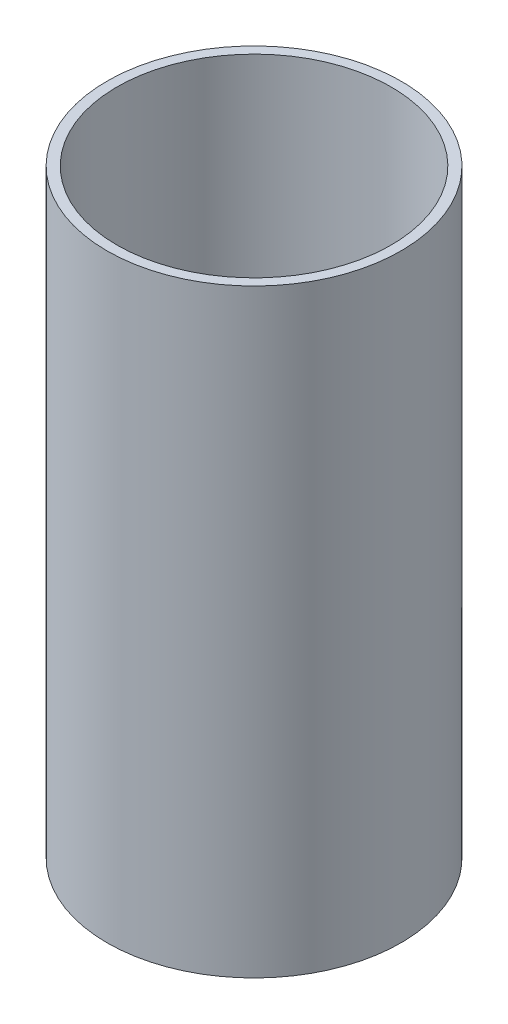
from build123d import *

# Parameters (mm, degrees)
ESQUISSE1_R        = 73.61
ESQUISSE1_R_2      = 68.61
BOSS_EXTRU_1_DEPTH = 300


with BuildPart() as part:
    # Esquisse1 → Boss.-Extru.1 (new body)
    with BuildSketch(Plane(origin=(0, 0, 0), x_dir=(1, 0, 0), z_dir=(0, 1, 0))):
        with Locations(Location((0, 0, 0), (0, 0, 270))):
            Circle(ESQUISSE1_R)
        with Locations(Location((0, 0, 0), (0, 0, 270))):
            Circle(ESQUISSE1_R_2, mode=Mode.SUBTRACT)
    extrude(amount=BOSS_EXTRU_1_DEPTH)


solid = part.part
